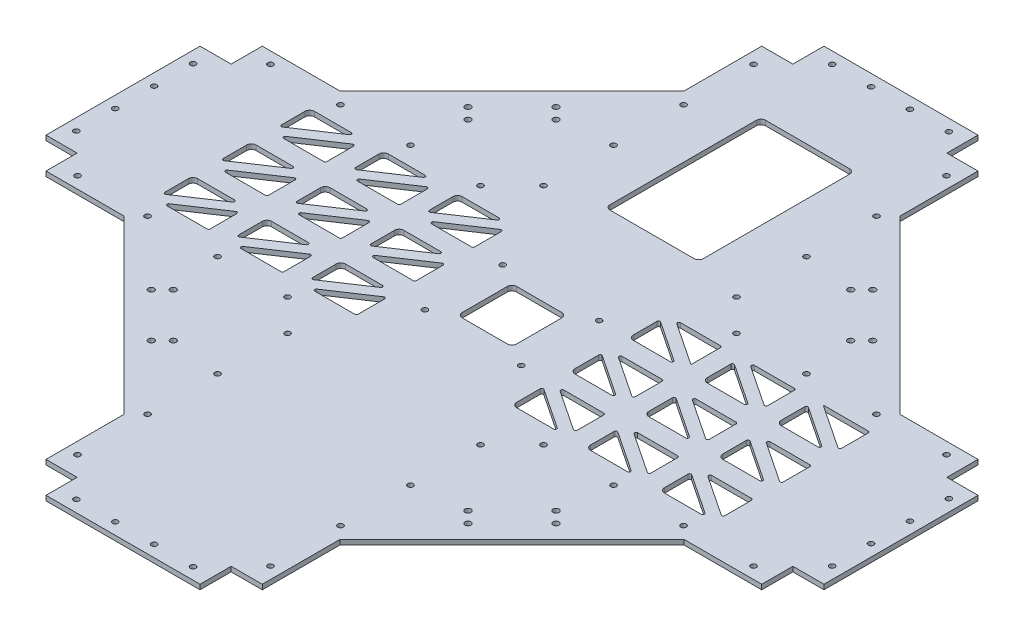
from build123d import *

# Parameters (mm, degrees)
SKETCH1_W           = 139
SKETCH1_H           = 139
BOSS_EXTRUDE1_DEPTH = 3.125
SKETCH2_W           = 20
SKETCH2_H           = 20
CUT_EXTRUDE1_DEPTH  = 354.567201003
SKETCH3_R           = 1.75
CUT_EXTRUDE2_DEPTH  = 354.567201003
SKETCH4_R           = 1.9
CUT_EXTRUDE3_DEPTH  = 354.567201003
SKETCH5_W           = 35
SKETCH5_H           = 35
SKETCH5_W_2         = 60
SKETCH5_H_2         = 100
CUT_EXTRUDE4_DEPTH  = 354.567201003
FILLET1_R           = 3
FILLET2_R           = 1


with BuildPart() as part:
    # Sketch1 → Boss-Extrude1 (new body)
    with BuildSketch(Plane(origin=(0, 0, 0), x_dir=(1, 0, 0), z_dir=(0, 1, 0))):
        Polygon((-180, -69.5), (-69.5, -69.5), (-69.5, 69.5), (-180, 69.5), (-250, 69.5), (-250, -69.5), align=None)
        Rectangle(SKETCH1_W, SKETCH1_H)
        Polygon((-69.5, 180), (-69.5, 69.5), (69.5, 69.5), (69.5, 180), (69.5, 250), (-69.5, 250), align=None)
        Polygon((69.5, 69.5), (69.5, -69.5), (180, -69.5), (250, -69.5), (250, 69.5), (180, 69.5), align=None)
        Polygon((-69.5, -180), (-69.5, -250), (69.5, -250), (69.5, -180), (69.5, -69.5), (-69.5, -69.5), align=None)
        Polygon((-180, 69.5), (-69.5, 69.5), (-69.5, 180), align=None)
        Polygon((-180, -69.5), (-69.5, -180), (-69.5, -69.5), align=None)
        Polygon((69.5, -69.5), (69.5, -180), (180, -69.5), align=None)
        Polygon((69.5, 180), (69.5, 69.5), (180, 69.5), align=None)
    extrude(amount=BOSS_EXTRUDE1_DEPTH)

    # Sketch2 → Cut-Extrude1 (cut, through all)
    with BuildSketch(Plane(origin=(0, 3.125, 0), x_dir=(1, 0, 0), z_dir=(0, 1, 0))):
        with Locations((-59.5, 240)):
            Rectangle(SKETCH2_W, SKETCH2_H)
        with Locations((59.5, 240)):
            Rectangle(SKETCH2_W, SKETCH2_H)
        with Locations((240, 59.5)):
            Rectangle(SKETCH2_W, SKETCH2_H)
        with Locations((240, -59.5)):
            Rectangle(SKETCH2_W, SKETCH2_H)
        with Locations((59.5, -240)):
            Rectangle(SKETCH2_W, SKETCH2_H)
        with Locations((-59.5, -240)):
            Rectangle(SKETCH2_W, SKETCH2_H)
        with Locations((-240, -59.5)):
            Rectangle(SKETCH2_W, SKETCH2_H)
        with Locations((-240, 59.5)):
            Rectangle(SKETCH2_W, SKETCH2_H)
    extrude(amount=-CUT_EXTRUDE1_DEPTH, mode=Mode.SUBTRACT)

    # Sketch3 → Cut-Extrude2 (cut, through all)
    with BuildSketch(Plane(origin=(0, 3.125, 0), x_dir=(1, 0, 0), z_dir=(0, 1, 0))):
        with Locations(Location((-242.5, -37.5, 0), (0, 0, 270))):
            Circle(SKETCH3_R)
        with Locations(Location((-242.5, -12.5, 0), (0, 0, 270))):
            Circle(SKETCH3_R)
        with Locations(Location((-242.5, 12.5, 0), (0, 0, 270))):
            Circle(SKETCH3_R)
        with Locations(Location((-242.5, 37.5, 0), (0, 0, 270))):
            Circle(SKETCH3_R)
        with Locations(Location((-217.25, 62, 0), (0, 0, 270))):
            Circle(SKETCH3_R)
        with Locations(Location((-172.25, 62, 0), (0, 0, 270))):
            Circle(SKETCH3_R)
        with Locations(Location((-127.25, 62, 0), (0, 0, 270))):
            Circle(SKETCH3_R)
        with Locations(Location((-82.25, 62, 0), (0, 0, 270))):
            Circle(SKETCH3_R)
        with Locations(Location((-217.25, -62, 0), (0, 0, 270))):
            Circle(SKETCH3_R)
        with Locations(Location((-172.25, -62, 0), (0, 0, 270))):
            Circle(SKETCH3_R)
        with Locations(Location((-127.25, -62, 0), (0, 0, 270))):
            Circle(SKETCH3_R)
        with Locations(Location((-82.25, -62, 0), (0, 0, 270))):
            Circle(SKETCH3_R)
        with Locations(Location((-62, 82.25, 0), (0, 0, 270))):
            Circle(SKETCH3_R)
        with Locations(Location((-62, 127.25, 0), (0, 0, 270))):
            Circle(SKETCH3_R)
        with Locations(Location((-62, 172.25, 0), (0, 0, 270))):
            Circle(SKETCH3_R)
        with Locations(Location((-62, 217.25, 0), (0, 0, 270))):
            Circle(SKETCH3_R)
        with Locations(Location((-36.75, 242.5, 0), (0, 0, 270))):
            Circle(SKETCH3_R)
        with Locations(Location((-11.75, 242.5, 0), (0, 0, 270))):
            Circle(SKETCH3_R)
        with Locations(Location((13.25, 242.5, 0), (0, 0, 270))):
            Circle(SKETCH3_R)
        with Locations(Location((38.25, 242.5, 0), (0, 0, 270))):
            Circle(SKETCH3_R)
        with Locations(Location((62, 82.25, 0), (0, 0, 270))):
            Circle(SKETCH3_R)
        with Locations(Location((62, 127.25, 0), (0, 0, 270))):
            Circle(SKETCH3_R)
        with Locations(Location((62, 172.25, 0), (0, 0, 270))):
            Circle(SKETCH3_R)
        with Locations(Location((62, 217.25, 0), (0, 0, 270))):
            Circle(SKETCH3_R)
        with Locations(Location((82.25, 62, 0), (0, 0, 90))):
            Circle(SKETCH3_R)
        with Locations(Location((127.25, 62, 0), (0, 0, 90))):
            Circle(SKETCH3_R)
        with Locations(Location((172.25, 62, 0), (0, 0, 90))):
            Circle(SKETCH3_R)
        with Locations(Location((217.25, 62, 0), (0, 0, 90))):
            Circle(SKETCH3_R)
        with Locations(Location((242.5, 38.25, 0), (0, 0, 90))):
            Circle(SKETCH3_R)
        with Locations(Location((242.5, 13.25, 0), (0, 0, 90))):
            Circle(SKETCH3_R)
        with Locations(Location((242.5, -11.75, 0), (0, 0, 90))):
            Circle(SKETCH3_R)
        with Locations(Location((242.5, -36.75, 0), (0, 0, 90))):
            Circle(SKETCH3_R)
        with Locations(Location((217.25, -62, 0), (0, 0, 90))):
            Circle(SKETCH3_R)
        with Locations(Location((172.25, -62, 0), (0, 0, 90))):
            Circle(SKETCH3_R)
        with Locations(Location((127.25, -62, 0), (0, 0, 90))):
            Circle(SKETCH3_R)
        with Locations(Location((82.25, -62, 0), (0, 0, 90))):
            Circle(SKETCH3_R)
        with Locations(Location((62, -82.25, 0), (0, 0, 90))):
            Circle(SKETCH3_R)
        with Locations(Location((62, -127.25, 0), (0, 0, 90))):
            Circle(SKETCH3_R)
        with Locations(Location((62, -172.25, 0), (0, 0, 90))):
            Circle(SKETCH3_R)
        with Locations(Location((62, -217.25, 0), (0, 0, 90))):
            Circle(SKETCH3_R)
        with Locations(Location((37.5, -242.5, 0), (0, 0, 90))):
            Circle(SKETCH3_R)
        with Locations(Location((12.5, -242.5, 0), (0, 0, 90))):
            Circle(SKETCH3_R)
        with Locations(Location((-12.5, -242.5, 0), (0, 0, 90))):
            Circle(SKETCH3_R)
        with Locations(Location((-37.5, -242.5, 0), (0, 0, 90))):
            Circle(SKETCH3_R)
        with Locations(Location((-62, -82.25, 0), (0, 0, 90))):
            Circle(SKETCH3_R)
        with Locations(Location((-62, -127.25, 0), (0, 0, 90))):
            Circle(SKETCH3_R)
        with Locations(Location((-62, -172.25, 0), (0, 0, 90))):
            Circle(SKETCH3_R)
        with Locations(Location((-62, -217.25, 0), (0, 0, 90))):
            Circle(SKETCH3_R)
        with Locations(Location((-31, 25, 0), (0, 0, 270))):
            Circle(SKETCH3_R)
        with Locations(Location((31, 25, 0), (0, 0, 270))):
            Circle(SKETCH3_R)
        with Locations(Location((31, -25, 0), (0, 0, 270))):
            Circle(SKETCH3_R)
        with Locations(Location((-31, -25, 0), (0, 0, 270))):
            Circle(SKETCH3_R)
    extrude(amount=-CUT_EXTRUDE2_DEPTH, mode=Mode.SUBTRACT)

    # Sketch4 → Cut-Extrude3 (cut, through all)
    with BuildSketch(Plane(origin=(0, 3.125, 0), x_dir=(1, 0, 0), z_dir=(0, 1, 0))):
        with Locations(Location((-101.769029611, 130.053300859, 0), (0, 0, 270))):
            Circle(SKETCH4_R)
        with Locations(Location((-94.6979618, 122.982233047, 0), (0, 0, 270))):
            Circle(SKETCH4_R)
        with Locations(Location((-130.053300859, 101.769029611, 0), (0, 0, 270))):
            Circle(SKETCH4_R)
        with Locations(Location((-122.982233047, 94.6979618, 0), (0, 0, 270))):
            Circle(SKETCH4_R)
        with Locations(Location((130.053300859, 101.769029611, 0), (0, 0, 270))):
            Circle(SKETCH4_R)
        with Locations(Location((122.982233047, 94.6979618, 0), (0, 0, 270))):
            Circle(SKETCH4_R)
        with Locations(Location((101.769029611, 130.053300859, 0), (0, 0, 270))):
            Circle(SKETCH4_R)
        with Locations(Location((94.6979618, 122.982233047, 0), (0, 0, 270))):
            Circle(SKETCH4_R)
        with Locations(Location((101.769029611, -130.053300859, 0), (0, 0, 270))):
            Circle(SKETCH4_R)
        with Locations(Location((94.6979618, -122.982233047, 0), (0, 0, 270))):
            Circle(SKETCH4_R)
        with Locations(Location((130.053300859, -101.769029611, 0), (0, 0, 270))):
            Circle(SKETCH4_R)
        with Locations(Location((122.982233047, -94.6979618, 0), (0, 0, 270))):
            Circle(SKETCH4_R)
        with Locations(Location((-130.053300859, -101.769029611, 0), (0, 0, 270))):
            Circle(SKETCH4_R)
        with Locations(Location((-122.982233047, -94.6979618, 0), (0, 0, 270))):
            Circle(SKETCH4_R)
        with Locations(Location((-101.769029611, -130.053300859, 0), (0, 0, 270))):
            Circle(SKETCH4_R)
        with Locations(Location((-94.6979618, -122.982233047, 0), (0, 0, 270))):
            Circle(SKETCH4_R)
    extrude(amount=-CUT_EXTRUDE3_DEPTH, mode=Mode.SUBTRACT)

    # Sketch5 → Cut-Extrude4 (cut, through all)
    with BuildSketch(Plane(origin=(0, 3.125, 0), x_dir=(1, 0, 0), z_dir=(0, 1, 0))):
        Rectangle(SKETCH5_W, SKETCH5_H)
        Polygon((50, 7.5), (80, -12.5), (50, -12.5), align=None)
        Polygon((-180, 50), (-180, 30), (-150, 50), align=None)
        Polygon((-145, 25), (-145, 45), (-175, 25), align=None)
        Polygon((-102.5, 50), (-132.5, 50), (-132.5, 30), align=None)
        Polygon((-127.5, 25), (-97.5, 25), (-97.5, 45), align=None)
        Polygon((-55, 50), (-85, 50), (-85, 30), align=None)
        Polygon((-80, 25), (-50, 25), (-50, 45), align=None)
        Polygon((-102.5, 12.5), (-132.5, 12.5), (-132.5, -7.5), align=None)
        Polygon((-127.5, -12.5), (-97.5, -12.5), (-97.5, 7.5), align=None)
        Polygon((-55, 12.5), (-85, 12.5), (-85, -7.5), align=None)
        Polygon((-80, -12.5), (-50, -12.5), (-50, 7.5), align=None)
        Polygon((-102.5, -25), (-132.5, -25), (-132.5, -45), align=None)
        Polygon((-127.5, -50), (-97.5, -50), (-97.5, -30), align=None)
        Polygon((-55, -25), (-85, -25), (-85, -45), align=None)
        Polygon((-80, -50), (-50, -50), (-50, -30), align=None)
        Polygon((-150, 12.5), (-180, 12.5), (-180, -7.5), align=None)
        Polygon((-175, -12.5), (-145, -12.5), (-145, 7.5), align=None)
        Polygon((-150, -25), (-180, -25), (-180, -45), align=None)
        Polygon((-175, -50), (-145, -50), (-145, -30), align=None)
        Polygon((85, -7.5), (55, 12.5), (85, 12.5), align=None)
        Polygon((50, 45), (80, 25), (50, 25), align=None)
        Polygon((85, 30), (55, 50), (85, 50), align=None)
        Polygon((97.5, 7.5), (127.5, -12.5), (97.5, -12.5), align=None)
        Polygon((132.5, -7.5), (102.5, 12.5), (132.5, 12.5), align=None)
        Polygon((97.5, 45), (127.5, 25), (97.5, 25), align=None)
        Polygon((132.5, 30), (102.5, 50), (132.5, 50), align=None)
        Polygon((145, 45), (175, 25), (145, 25), align=None)
        Polygon((180, 30), (150, 50), (180, 50), align=None)
        Polygon((180, -7.5), (150, 12.5), (180, 12.5), align=None)
        Polygon((145, 7.5), (175, -12.5), (145, -12.5), align=None)
        Polygon((180, -45), (150, -25), (180, -25), align=None)
        Polygon((145, -30), (175, -50), (145, -50), align=None)
        Polygon((132.5, -45), (102.5, -25), (132.5, -25), align=None)
        Polygon((97.5, -30), (127.5, -50), (97.5, -50), align=None)
        Polygon((85, -45), (55, -25), (85, -25), align=None)
        Polygon((50, -30), (80, -50), (50, -50), align=None)
        with Locations((0, 140)):
            Rectangle(SKETCH5_W_2, SKETCH5_H_2)
    extrude(amount=-CUT_EXTRUDE4_DEPTH, mode=Mode.SUBTRACT)

    # Fillet1
    fillet1_edges = [part.edges().sort_by_distance(p)[0] for p in [
        (-180, 1.5625, -12.5),
        (-180, 1.5625, 25),
        (50, 1.5625, -25),
        (97.5, 1.5625, 12.5),
        (97.5, 1.5625, -25),
        (145, 1.5625, -25),
        (145, 1.5625, 12.5),
        (145, 1.5625, 50),
        (-85, 1.5625, -50),
        (-132.5, 1.5625, -50),
        (-180, 1.5625, -50),
        (50, 1.5625, 12.5),
        (-132.5, 1.5625, -12.5),
        (-85, 1.5625, -12.5),
        (-132.5, 1.5625, 25),
        (-85, 1.5625, 25),
        (97.5, 1.5625, 50),
        (50, 1.5625, 50),
        (30, 1.5625, -190),
        (30, 1.5625, -90),
        (-30, 1.5625, -90),
        (-30, 1.5625, -190),
        (17.5, 1.5625, -17.5),
        (17.5, 1.5625, 17.5),
        (-17.5, 1.5625, 17.5),
        (-17.5, 1.5625, -17.5),
    ]]
    fillet(fillet1_edges, radius=FILLET1_R)

    # Fillet2
    fillet2_edges = [part.edges().sort_by_distance(p)[0] for p in [
        (-145, 1.5625, -7.5),
        (-145, 1.5625, 12.5),
        (-175, 1.5625, 12.5),
        (-180, 1.5625, 7.5),
        (-150, 1.5625, -12.5),
        (-145, 1.5625, 30),
        (-145, 1.5625, 50),
        (-175, 1.5625, 50),
        (-180, 1.5625, 45),
        (-150, 1.5625, 25),
        (85, 1.5625, -50),
        (55, 1.5625, -50),
        (50, 1.5625, -45),
        (80, 1.5625, -25),
        (132.5, 1.5625, -12.5),
        (132.5, 1.5625, 7.5),
        (102.5, 1.5625, -12.5),
        (97.5, 1.5625, -7.5),
        (127.5, 1.5625, 12.5),
        (132.5, 1.5625, -50),
        (132.5, 1.5625, -30),
        (102.5, 1.5625, -50),
        (97.5, 1.5625, -45),
        (127.5, 1.5625, -25),
        (180, 1.5625, -50),
        (180, 1.5625, -30),
        (145, 1.5625, -45),
        (175, 1.5625, -25),
        (145, 1.5625, -7.5),
        (175, 1.5625, 12.5),
        (180, 1.5625, -12.5),
        (180, 1.5625, 7.5),
        (150, 1.5625, -12.5),
        (145, 1.5625, 30),
        (175, 1.5625, 50),
        (180, 1.5625, 25),
        (180, 1.5625, 45),
        (150, 1.5625, 25),
        (-85, 1.5625, -30),
        (-55, 1.5625, -50),
        (-50, 1.5625, -45),
        (-50, 1.5625, -25),
        (-80, 1.5625, -25),
        (-132.5, 1.5625, -30),
        (-102.5, 1.5625, -50),
        (-97.5, 1.5625, -45),
        (-97.5, 1.5625, -25),
        (-127.5, 1.5625, -25),
        (-150, 1.5625, -50),
        (-180, 1.5625, -30),
        (50, 1.5625, -7.5),
        (80, 1.5625, 12.5),
        (85, 1.5625, -12.5),
        (85, 1.5625, 7.5),
        (55, 1.5625, -12.5),
        (-145, 1.5625, -25),
        (-175, 1.5625, -25),
        (-145, 1.5625, -45),
        (-97.5, 1.5625, -7.5),
        (-97.5, 1.5625, 12.5),
        (-127.5, 1.5625, 12.5),
        (-132.5, 1.5625, 7.5),
        (-102.5, 1.5625, -12.5),
        (-50, 1.5625, -7.5),
        (-50, 1.5625, 12.5),
        (-80, 1.5625, 12.5),
        (-85, 1.5625, 7.5),
        (-55, 1.5625, -12.5),
        (-97.5, 1.5625, 30),
        (-97.5, 1.5625, 50),
        (-127.5, 1.5625, 50),
        (-132.5, 1.5625, 45),
        (-102.5, 1.5625, 25),
        (-50, 1.5625, 30),
        (-50, 1.5625, 50),
        (-80, 1.5625, 50),
        (-85, 1.5625, 45),
        (-55, 1.5625, 25),
        (97.5, 1.5625, 30),
        (127.5, 1.5625, 50),
        (132.5, 1.5625, 25),
        (132.5, 1.5625, 45),
        (102.5, 1.5625, 25),
        (50, 1.5625, 30),
        (80, 1.5625, 50),
        (85, 1.5625, 25),
        (85, 1.5625, 45),
        (55, 1.5625, 25),
    ]]
    fillet(fillet2_edges, radius=FILLET2_R)


solid = part.part
